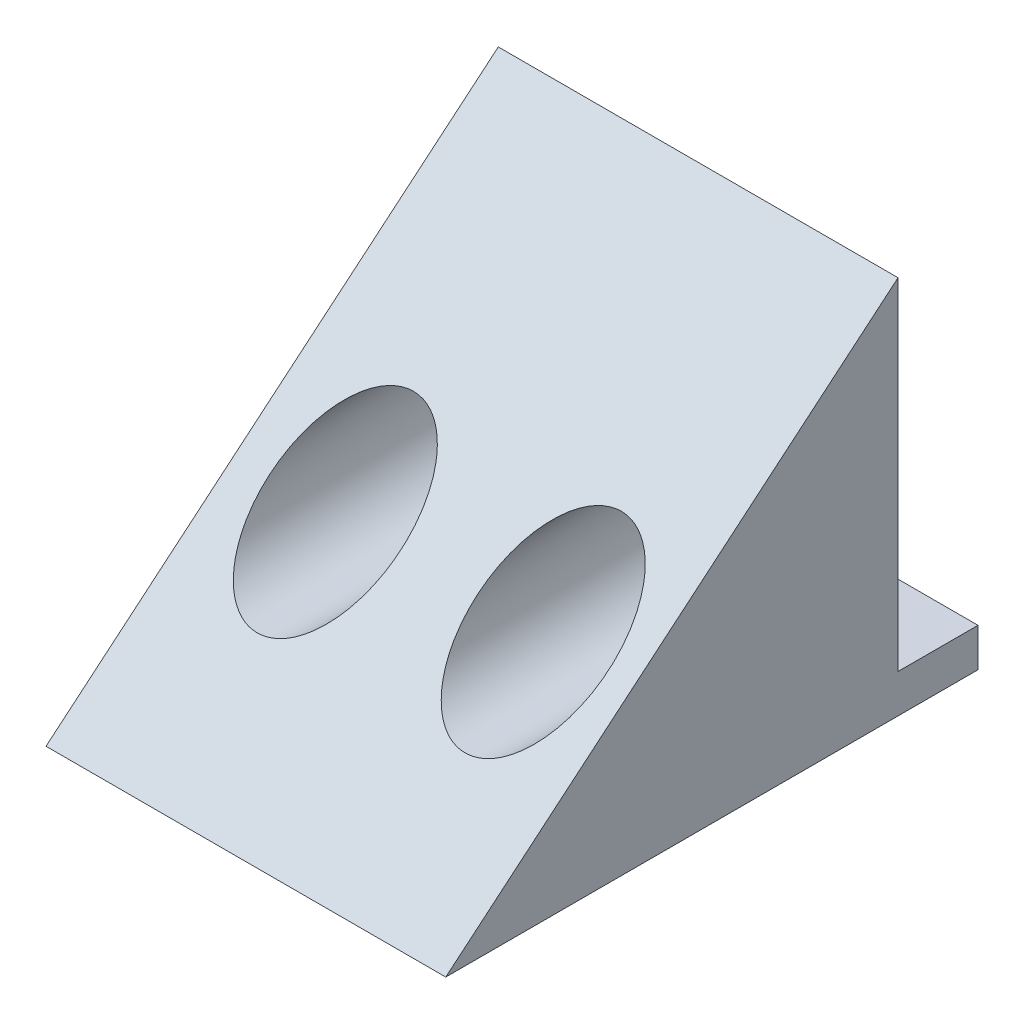
from build123d import *

# Parameters (mm, degrees)
BOSS_EXTRUDE1_DEPTH = 50
SKETCH6_R           = 8.2
CUT_EXTRUDE5_DEPTH  = 75.17
SKETCH7_W           = 50
SKETCH7_H           = 4.818652416
BOSS_EXTRUDE3_DEPTH = 10
SKETCH8_R           = 1.585
CUT_EXTRUDE6_DEPTH  = 10


with BuildPart() as part:
    # Sketch1 → Boss-Extrude1 (new body)
    with BuildSketch(Plane(origin=(0, 0, 0), x_dir=(0, 0, -1), z_dir=(1, 0, 0))):
        Polygon((0, 0), (56.567210857, 0), (56.567210857, 47.465525767), align=None)
    extrude(amount=BOSS_EXTRUDE1_DEPTH)

    # Sketch6 → Cut-Extrude5 (cut)
    with BuildSketch(Plane(origin=(0, 0, -56.567210857), x_dir=(-1, 0, 0), z_dir=(0, 0, -1))):
        with Locations((-38.554443975, 19.83)):
            Circle(SKETCH6_R)
        with Locations((-12.554443975, 19.83)):
            Circle(SKETCH6_R)
    extrude(amount=-CUT_EXTRUDE5_DEPTH, mode=Mode.SUBTRACT)

    # Sketch7 → Boss-Extrude3 (add)
    with BuildSketch(Plane(origin=(0, 0, -56.567210857), x_dir=(-1, 0, 0), z_dir=(0, 0, -1))):
        with Locations((-25, 2.409326208)):
            Rectangle(SKETCH7_W, SKETCH7_H)
    extrude(amount=BOSS_EXTRUDE3_DEPTH)

    # Sketch8 → Cut-Extrude6 (cut)
    with BuildSketch(Plane(origin=(0, 4.818652416, 0), x_dir=(1, 0, 0), z_dir=(0, 1, 0))):
        with Locations(Location((24.681935477, 61.878402744, 0), (0, 0, 270))):
            Circle(SKETCH8_R)
    extrude(amount=-CUT_EXTRUDE6_DEPTH, mode=Mode.SUBTRACT)


solid = part.part
